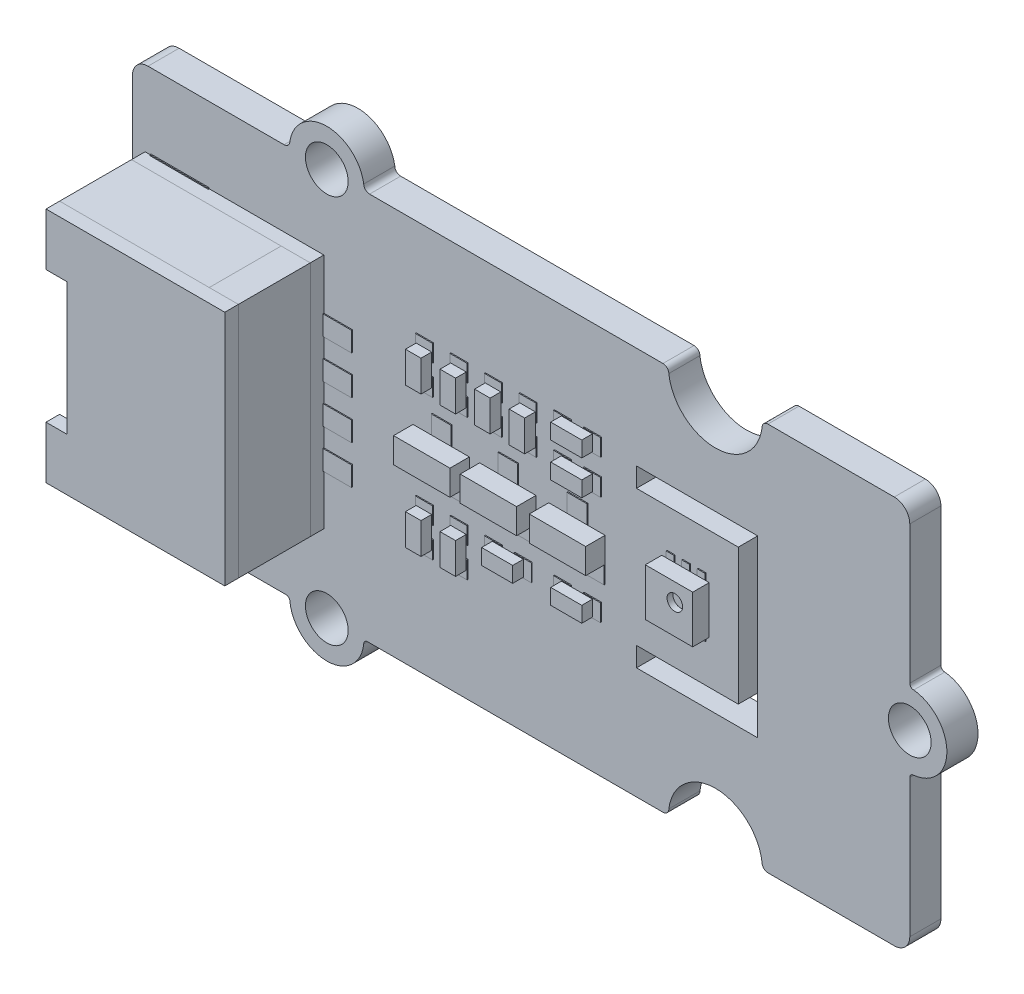
from build123d import *

# Parameters (mm, degrees)
ESQUISSE1_R                                    = 1.1
ESQUISSE1_R_2                                  = 1.100000001
PCB_CONTOUR_PERCAGES_ET_ISOLATION_EAGLE_DEPTH  = 1.6
GROVE_BASE_H_ESTIMEE_START                     = 1.6
ESQUISSE2_W                                    = 9.2
ESQUISSE2_H                                    = 12.2
GROVE_BASE_H_ESTIMEE_DEPTH                     = 0.7
GROVE_DOS_START                                = 2.3
ESQUISSE3_W                                    = 1.5
ESQUISSE3_H                                    = 12.2
GROVE_DOS_DEPTH                                = 3.7
GROVE_FLANCS_START                             = 2.3
ESQUISSE4_W                                    = 7.7
ESQUISSE4_H                                    = 0.7
GROVE_FLANCS_DEPTH                             = 3.7
GROVE_FLANCS_2_DEPTH                           = 3.7
GROVE_TOIT_START                               = 6
ESQUISSE5_W                                    = 9.2
ESQUISSE5_H                                    = 12.2
GROVE_TOIT_DEPTH                               = 0.7
ENCOCHE_GROVE_START                            = 6.7
ESQUISSE6_W                                    = 1.1
ESQUISSE6_H                                    = 6.8
ENCOCHE_GROVE_DEPTH                            = 0.7
BROCHES_HORIZONTALES_GROVE_START               = 3.4
ESQUISSE7_W                                    = 5.52
ESQUISSE7_H                                    = 0.5
BROCHES_HORIZONTALES_GROVE_DEPTH               = 0.5
BROCHES_HORIZONTALES_GROVE_2_DEPTH             = 0.5
BROCHES_HORIZONTALES_GROVE_3_DEPTH             = 0.5
BROCHES_HORIZONTALES_GROVE_4_DEPTH             = 0.5
SGP40_2_44X2_44X0_85_START                     = 1.65
ESQUISSE8_W                                    = 2.44
ESQUISSE8_H                                    = 2.44
SGP40_2_44X2_44X0_85_DEPTH                     = 0.85
OUVERTURE_SGP40_DIAM0_8_PROFONDEUR_ESTIM_START = 2.5
ESQUISSE9_R                                    = 0.4
OUVERTURE_SGP40_DIAM0_8_PROFONDEUR_ESTIM_DEPTH = 0.3
C1_POSITION_EAGLE_START                        = 1.65
ESQUISSE10_W                                   = 1.6
ESQUISSE10_H                                   = 0.8
C1_POSITION_EAGLE_DEPTH                        = 0.55
C2_POSITION_EAGLE_START                        = 1.65
ESQUISSE11_W                                   = 1.6
ESQUISSE11_H                                   = 0.8
C2_POSITION_EAGLE_DEPTH                        = 0.55
U2_POSITION_EAGLE_START                        = 1.65
ESQUISSE12_W                                   = 2.9
ESQUISSE12_H                                   = 1.3
U2_POSITION_EAGLE_DEPTH                        = 1
C3_POSITION_EAGLE_START                        = 1.65
ESQUISSE13_W                                   = 0.8
ESQUISSE13_H                                   = 1.6
C3_POSITION_EAGLE_DEPTH                        = 0.55
C4_POSITION_EAGLE_START                        = 1.65
ESQUISSE14_W                                   = 0.8
ESQUISSE14_H                                   = 1.6
C4_POSITION_EAGLE_DEPTH                        = 0.55
C5_POSITION_EAGLE_START                        = 1.65
ESQUISSE15_W                                   = 0.8
ESQUISSE15_H                                   = 1.6
C5_POSITION_EAGLE_DEPTH                        = 0.55
C6_POSITION_EAGLE_START                        = 1.65
ESQUISSE16_W                                   = 0.8
ESQUISSE16_H                                   = 1.6
C6_POSITION_EAGLE_DEPTH                        = 0.55
Q7_POSITION_EAGLE_START                        = 1.65
ESQUISSE17_W                                   = 2.9
ESQUISSE17_H                                   = 1.3
Q7_POSITION_EAGLE_DEPTH                        = 1
Q8_POSITION_EAGLE_START                        = 1.65
ESQUISSE18_W                                   = 2.9
ESQUISSE18_H                                   = 1.3
Q8_POSITION_EAGLE_DEPTH                        = 1
R20_POSITION_EAGLE_START                       = 1.65
ESQUISSE19_W                                   = 1.6
ESQUISSE19_H                                   = 0.8
R20_POSITION_EAGLE_DEPTH                       = 0.55
R21_POSITION_EAGLE_START                       = 1.65
ESQUISSE20_W                                   = 1.6
ESQUISSE20_H                                   = 0.8
R21_POSITION_EAGLE_DEPTH                       = 0.55
R22_POSITION_EAGLE_START                       = 1.65
ESQUISSE21_W                                   = 0.8
ESQUISSE21_H                                   = 1.6
R22_POSITION_EAGLE_DEPTH                       = 0.55
R23_POSITION_EAGLE_START                       = 1.65
ESQUISSE22_W                                   = 0.8
ESQUISSE22_H                                   = 1.6
R23_POSITION_EAGLE_DEPTH                       = 0.55
PAD_C1_0_START                                 = 1.6
ESQUISSE23_W                                   = 0.889
ESQUISSE23_H                                   = 0.889
PAD_C1_0_DEPTH                                 = 0.05
PAD_C1_1_START                                 = 1.6
ESQUISSE24_W                                   = 0.889
ESQUISSE24_H                                   = 0.889
PAD_C1_1_DEPTH                                 = 0.05
PAD_C2_0_START                                 = 1.6
ESQUISSE25_W                                   = 0.889
ESQUISSE25_H                                   = 0.889
PAD_C2_0_DEPTH                                 = 0.05
PAD_C2_1_START                                 = 1.6
ESQUISSE26_W                                   = 0.889
ESQUISSE26_H                                   = 0.889
PAD_C2_1_DEPTH                                 = 0.05
PAD_J1_0_START                                 = 1.6
ESQUISSE27_W                                   = 2.74
ESQUISSE27_H                                   = 1.01
PAD_J1_0_DEPTH                                 = 0.05
PAD_J1_1_START                                 = 1.6
ESQUISSE28_W                                   = 2.74
ESQUISSE28_H                                   = 1.01
PAD_J1_1_DEPTH                                 = 0.05
PAD_J1_2_START                                 = 1.6
ESQUISSE29_W                                   = 2.74
ESQUISSE29_H                                   = 1.01
PAD_J1_2_DEPTH                                 = 0.05
PAD_J1_3_START                                 = 1.6
ESQUISSE30_W                                   = 2.74
ESQUISSE30_H                                   = 1.01
PAD_J1_3_DEPTH                                 = 0.05
PAD_J1_4_START                                 = 1.6
ESQUISSE31_W                                   = 3
ESQUISSE31_H                                   = 1.5
PAD_J1_4_DEPTH                                 = 0.05
PAD_J1_5_START                                 = 1.6
ESQUISSE32_W                                   = 3
ESQUISSE32_H                                   = 1.5
PAD_J1_5_DEPTH                                 = 0.05
PAD_U2_0_START                                 = 1.6
ESQUISSE33_W                                   = 1.016
ESQUISSE33_H                                   = 1.143
PAD_U2_0_DEPTH                                 = 0.05
PAD_U2_1_START                                 = 1.6
ESQUISSE34_W                                   = 1.016
ESQUISSE34_H                                   = 1.143
PAD_U2_1_DEPTH                                 = 0.05
PAD_U2_2_START                                 = 1.6
ESQUISSE35_W                                   = 1.016
ESQUISSE35_H                                   = 1.143
PAD_U2_2_DEPTH                                 = 0.05
PAD_C3_0_START                                 = 1.6
ESQUISSE36_W                                   = 0.889
ESQUISSE36_H                                   = 0.889
PAD_C3_0_DEPTH                                 = 0.05
PAD_C3_1_START                                 = 1.6
ESQUISSE37_W                                   = 0.889
ESQUISSE37_H                                   = 0.889
PAD_C3_1_DEPTH                                 = 0.05
PAD_C4_0_START                                 = 1.6
ESQUISSE38_W                                   = 0.889
ESQUISSE38_H                                   = 0.889
PAD_C4_0_DEPTH                                 = 0.05
PAD_C4_1_START                                 = 1.6
ESQUISSE39_W                                   = 0.889
ESQUISSE39_H                                   = 0.889
PAD_C4_1_DEPTH                                 = 0.05
PAD_C5_0_START                                 = 1.6
ESQUISSE40_W                                   = 0.889
ESQUISSE40_H                                   = 0.889
PAD_C5_0_DEPTH                                 = 0.05
PAD_C5_1_START                                 = 1.6
ESQUISSE41_W                                   = 0.889
ESQUISSE41_H                                   = 0.889
PAD_C5_1_DEPTH                                 = 0.05
PAD_C6_0_START                                 = 1.6
ESQUISSE42_W                                   = 0.889
ESQUISSE42_H                                   = 0.889
PAD_C6_0_DEPTH                                 = 0.05
PAD_C6_1_START                                 = 1.6
ESQUISSE43_W                                   = 0.889
ESQUISSE43_H                                   = 0.889
PAD_C6_1_DEPTH                                 = 0.05
PAD_Q7_0_START                                 = 1.6
ESQUISSE44_W                                   = 1.016
ESQUISSE44_H                                   = 1.143
PAD_Q7_0_DEPTH                                 = 0.05
PAD_Q7_1_START                                 = 1.6
ESQUISSE45_W                                   = 1.016
ESQUISSE45_H                                   = 1.143
PAD_Q7_1_DEPTH                                 = 0.05
PAD_Q7_2_START                                 = 1.6
ESQUISSE46_W                                   = 1.016
ESQUISSE46_H                                   = 1.143
PAD_Q7_2_DEPTH                                 = 0.05
PAD_Q8_0_START                                 = 1.6
ESQUISSE47_W                                   = 1.016
ESQUISSE47_H                                   = 1.143
PAD_Q8_0_DEPTH                                 = 0.05
PAD_Q8_1_START                                 = 1.6
ESQUISSE48_W                                   = 1.016
ESQUISSE48_H                                   = 1.143
PAD_Q8_1_DEPTH                                 = 0.05
PAD_Q8_2_START                                 = 1.6
ESQUISSE49_W                                   = 1.016
ESQUISSE49_H                                   = 1.143
PAD_Q8_2_DEPTH                                 = 0.05
PAD_R20_0_START                                = 1.6
ESQUISSE50_W                                   = 0.889
ESQUISSE50_H                                   = 0.889
PAD_R20_0_DEPTH                                = 0.05
PAD_R20_1_START                                = 1.6
ESQUISSE51_W                                   = 0.889
ESQUISSE51_H                                   = 0.889
PAD_R20_1_DEPTH                                = 0.05
PAD_R21_0_START                                = 1.6
ESQUISSE52_W                                   = 0.889
ESQUISSE52_H                                   = 0.889
PAD_R21_0_DEPTH                                = 0.05
PAD_R21_1_START                                = 1.6
ESQUISSE53_W                                   = 0.889
ESQUISSE53_H                                   = 0.889
PAD_R21_1_DEPTH                                = 0.05
PAD_R22_0_START                                = 1.6
ESQUISSE54_W                                   = 0.889
ESQUISSE54_H                                   = 0.889
PAD_R22_0_DEPTH                                = 0.05
PAD_R22_1_START                                = 1.6
ESQUISSE55_W                                   = 0.889
ESQUISSE55_H                                   = 0.889
PAD_R22_1_DEPTH                                = 0.05
PAD_R23_0_START                                = 1.6
ESQUISSE56_W                                   = 0.889
ESQUISSE56_H                                   = 0.889
PAD_R23_0_DEPTH                                = 0.05
PAD_R23_1_START                                = 1.6
ESQUISSE57_W                                   = 0.889
ESQUISSE57_H                                   = 0.889
PAD_R23_1_DEPTH                                = 0.05
PAD_U1_0_START                                 = 1.6
ESQUISSE58_W                                   = 0.4
ESQUISSE58_H                                   = 0.65
PAD_U1_0_DEPTH                                 = 0.05
PAD_U1_1_START                                 = 1.6
ESQUISSE59_W                                   = 0.4
ESQUISSE59_H                                   = 0.65
PAD_U1_1_DEPTH                                 = 0.05
PAD_U1_2_START                                 = 1.6
ESQUISSE60_W                                   = 0.4
ESQUISSE60_H                                   = 0.65
PAD_U1_2_DEPTH                                 = 0.05
PAD_U1_3_START                                 = 1.6
ESQUISSE61_W                                   = 0.4
ESQUISSE61_H                                   = 0.65
PAD_U1_3_DEPTH                                 = 0.05
PAD_U1_4_START                                 = 1.6
ESQUISSE62_W                                   = 0.4
ESQUISSE62_H                                   = 0.65
PAD_U1_4_DEPTH                                 = 0.05
PAD_U1_5_START                                 = 1.6
ESQUISSE63_W                                   = 0.4
ESQUISSE63_H                                   = 0.65
PAD_U1_5_DEPTH                                 = 0.05
PAD_U1_6_START                                 = 1.6
ESQUISSE64_W                                   = 1.5
ESQUISSE64_H                                   = 1.05
PAD_U1_6_DEPTH                                 = 0.05


with BuildPart() as part:
    # Esquisse1 → PCB_contour_percages_et_isolation_Eagle_ep_ESTIMEE_1_6 (new body)
    with BuildSketch(Plane.XY):
        with BuildLine():
            Line((19.365, -9.2), (19.365, -2.1))
            ThreePointArc((19.365, -2.1), (19.423578644, -1.958578644), (19.565, -1.9))
            ThreePointArc((19.565, -1.9), (21.275497316, 0), (19.565, 1.9))
            ThreePointArc((19.565, 1.9), (19.423578644, 1.958578644), (19.365, 2.1))
            Line((19.365, 2.1), (19.365, 9.2))
            ThreePointArc((19.365, 9.2), (19.130685425, 9.765685425), (18.565, 10))
            Line((18.565, 10), (12.065, 10))
            ThreePointArc((12.065, 10), (11.852867966, 9.912132034), (11.765, 9.7))
            ThreePointArc((11.765, 9.7), (9.365, 7.581322681), (6.965, 9.7))
            ThreePointArc((6.965, 9.7), (6.877132034, 9.912132034), (6.665, 10))
            Line((6.665, 10), (-8.435, 10))
            ThreePointArc((-8.435, 10), (-8.647132034, 10.087867966), (-8.735, 10.3))
            ThreePointArc((-8.735, 10.3), (-10.635, 11.923538409), (-12.535, 10.3))
            ThreePointArc((-12.535, 10.3), (-12.622867966, 10.087867966), (-12.835, 10))
            Line((-12.835, 10), (-19.835, 10))
            ThreePointArc((-19.835, 10), (-20.400685425, 9.765685425), (-20.635, 9.2))
            Line((-20.635, 9.2), (-20.635, 2.7))
            ThreePointArc((-20.635, 2.7), (-20.547132034, 2.487867966), (-20.335, 2.4))
            ThreePointArc((-20.335, 2.4), (-18.216322681, 0), (-20.335, -2.4))
            ThreePointArc((-20.335, -2.4), (-20.547132034, -2.487867966), (-20.635, -2.7))
            Line((-20.635, -2.7), (-20.635, -9.2))
            ThreePointArc((-20.635, -9.2), (-20.400685425, -9.765685425), (-19.835, -10))
            Line((-19.835, -10), (-12.735, -10))
            ThreePointArc((-12.735, -10), (-12.593578644, -10.058578644), (-12.535, -10.2))
            ThreePointArc((-12.535, -10.2), (-10.635, -11.910497316), (-8.735, -10.2))
            ThreePointArc((-8.735, -10.2), (-8.676421356, -10.058578644), (-8.535, -10))
            Line((-8.535, -10), (6.665, -10))
            ThreePointArc((6.665, -10), (6.877132034, -9.912132034), (6.965, -9.7))
            ThreePointArc((6.965, -9.7), (9.365, -7.581322681), (11.765, -9.7))
            ThreePointArc((11.765, -9.7), (11.852867966, -9.912132034), (12.065, -10))
            Line((12.065, -10), (18.565, -10))
            ThreePointArc((18.565, -10), (19.130685425, -9.765685425), (19.365, -9.2))
        make_face()
        with Locations((-10.635, -9.999999999)):
            Circle(ESQUISSE1_R, mode=Mode.SUBTRACT)
        with Locations((-10.635, 10.000000004)):
            Circle(ESQUISSE1_R, mode=Mode.SUBTRACT)
        with Locations((19.364999999, 0)):
            Circle(ESQUISSE1_R_2, mode=Mode.SUBTRACT)
        Polygon((5.301, 3.754), (10.539, 3.754), (10.539, -3.246), (5.301, -3.246), (5.301, -4.246), (11.539, -4.246), (11.539, 4.754), (5.301, 4.754), align=None, mode=Mode.SUBTRACT)
    extrude(amount=PCB_CONTOUR_PERCAGES_ET_ISOLATION_EAGLE_DEPTH)


with BuildPart() as body_2:
    # Esquisse2 → Grove_base_H_ESTIMEE (new body)
    with BuildSketch(Plane.XY.offset(GROVE_BASE_H_ESTIMEE_START)):
        with Locations((-15.384840625, 0.0101625)):
            Rectangle(ESQUISSE2_W, ESQUISSE2_H)
    extrude(amount=GROVE_BASE_H_ESTIMEE_DEPTH)


with BuildPart() as body_3:
    # Esquisse3 → Grove_dos (new body)
    with BuildSketch(Plane.XY.offset(GROVE_DOS_START)):
        with Locations((-11.534840625, 0.0101625)):
            Rectangle(ESQUISSE3_W, ESQUISSE3_H)
    extrude(amount=GROVE_DOS_DEPTH)


with BuildPart() as body_4:
    # Esquisse4 → Grove_flancs (new body)
    with BuildSketch(Plane.XY.offset(GROVE_FLANCS_START)):
        with Locations((-16.134840625, -5.7398375)):
            Rectangle(ESQUISSE4_W, ESQUISSE4_H)
    extrude(amount=GROVE_FLANCS_DEPTH)


with BuildPart() as body_5:
    # Esquisse4 → Grove_flancs 2 (new body)
    with BuildSketch(Plane.XY.offset(GROVE_FLANCS_START)):
        with Locations((-16.134840625, 5.7601625)):
            Rectangle(ESQUISSE4_W, ESQUISSE4_H)
    extrude(amount=GROVE_FLANCS_2_DEPTH)


with BuildPart() as body_6:
    # Esquisse5 → Grove_toit (new body)
    with BuildSketch(Plane.XY.offset(GROVE_TOIT_START)):
        with Locations((-15.384840625, 0.0101625)):
            Rectangle(ESQUISSE5_W, ESQUISSE5_H)
    extrude(amount=GROVE_TOIT_DEPTH)

    # Esquisse6 → Encoche_Grove (cut)
    with BuildSketch(Plane.XY.offset(ENCOCHE_GROVE_START)):
        with Locations((-19.45, 0.01)):
            Rectangle(ESQUISSE6_W, ESQUISSE6_H)
    extrude(amount=-ENCOCHE_GROVE_DEPTH, mode=Mode.SUBTRACT)


with BuildPart() as body_7:
    # Esquisse7 → Broches_horizontales_Grove (new body)
    with BuildSketch(Plane.XY.offset(BROCHES_HORIZONTALES_GROVE_START)):
        with Locations((-15.04, -2.99)):
            Rectangle(ESQUISSE7_W, ESQUISSE7_H)
    extrude(amount=BROCHES_HORIZONTALES_GROVE_DEPTH)


with BuildPart() as body_8:
    # Esquisse7 → Broches_horizontales_Grove 2 (new body)
    with BuildSketch(Plane.XY.offset(BROCHES_HORIZONTALES_GROVE_START)):
        with Locations((-15.04, -0.99)):
            Rectangle(ESQUISSE7_W, ESQUISSE7_H)
    extrude(amount=BROCHES_HORIZONTALES_GROVE_2_DEPTH)


with BuildPart() as body_9:
    # Esquisse7 → Broches_horizontales_Grove 3 (new body)
    with BuildSketch(Plane.XY.offset(BROCHES_HORIZONTALES_GROVE_START)):
        with Locations((-15.04, 1.01)):
            Rectangle(ESQUISSE7_W, ESQUISSE7_H)
    extrude(amount=BROCHES_HORIZONTALES_GROVE_3_DEPTH)


with BuildPart() as body_10:
    # Esquisse7 → Broches_horizontales_Grove 4 (new body)
    with BuildSketch(Plane.XY.offset(BROCHES_HORIZONTALES_GROVE_START)):
        with Locations((-15.04, 3.01)):
            Rectangle(ESQUISSE7_W, ESQUISSE7_H)
    extrude(amount=BROCHES_HORIZONTALES_GROVE_4_DEPTH)


with BuildPart() as body_11:
    # Esquisse8 → SGP40_2_44x2_44x0_85 (new body)
    with BuildSketch(Plane.XY.offset(SGP40_2_44X2_44X0_85_START)):
        with Locations((7.874, 0.254)):
            Rectangle(ESQUISSE8_W, ESQUISSE8_H)
    extrude(amount=SGP40_2_44X2_44X0_85_DEPTH)

    # Esquisse9 → Ouverture_SGP40_diam0_8_profondeur_ESTIMEE (cut)
    with BuildSketch(Plane.XY.offset(OUVERTURE_SGP40_DIAM0_8_PROFONDEUR_ESTIM_START)):
        with Locations((8.174, 0.554)):
            Circle(ESQUISSE9_R)
    extrude(amount=-OUVERTURE_SGP40_DIAM0_8_PROFONDEUR_ESTIM_DEPTH, mode=Mode.SUBTRACT)


with BuildPart() as body_12:
    # Esquisse10 → C1_position_Eagle (new body)
    with BuildSketch(Plane.XY.offset(C1_POSITION_EAGLE_START)):
        with Locations((2.286, 2.921)):
            Rectangle(ESQUISSE10_W, ESQUISSE10_H)
    extrude(amount=C1_POSITION_EAGLE_DEPTH)


with BuildPart() as body_13:
    # Esquisse11 → C2_position_Eagle (new body)
    with BuildSketch(Plane.XY.offset(C2_POSITION_EAGLE_START)):
        with Locations((2.286, 4.699)):
            Rectangle(ESQUISSE11_W, ESQUISSE11_H)
    extrude(amount=C2_POSITION_EAGLE_DEPTH)


with BuildPart() as body_14:
    # Esquisse12 → U2_position_Eagle (new body)
    with BuildSketch(Plane.XY.offset(U2_POSITION_EAGLE_START)):
        with Locations((-4.699, 0.254)):
            Rectangle(ESQUISSE12_W, ESQUISSE12_H)
    extrude(amount=U2_POSITION_EAGLE_DEPTH)


with BuildPart() as body_15:
    # Esquisse13 → C3_position_Eagle (new body)
    with BuildSketch(Plane.XY.offset(C3_POSITION_EAGLE_START)):
        with Locations((-5.588, 3.81)):
            Rectangle(ESQUISSE13_W, ESQUISSE13_H)
    extrude(amount=C3_POSITION_EAGLE_DEPTH)


with BuildPart() as body_16:
    # Esquisse14 → C4_position_Eagle (new body)
    with BuildSketch(Plane.XY.offset(C4_POSITION_EAGLE_START)):
        with Locations((-3.81, 3.81)):
            Rectangle(ESQUISSE14_W, ESQUISSE14_H)
    extrude(amount=C4_POSITION_EAGLE_DEPTH)


with BuildPart() as body_17:
    # Esquisse15 → C5_position_Eagle (new body)
    with BuildSketch(Plane.XY.offset(C5_POSITION_EAGLE_START)):
        with Locations((-5.588, -3.429)):
            Rectangle(ESQUISSE15_W, ESQUISSE15_H)
    extrude(amount=C5_POSITION_EAGLE_DEPTH)


with BuildPart() as body_18:
    # Esquisse16 → C6_position_Eagle (new body)
    with BuildSketch(Plane.XY.offset(C6_POSITION_EAGLE_START)):
        with Locations((-3.81, -3.429)):
            Rectangle(ESQUISSE16_W, ESQUISSE16_H)
    extrude(amount=C6_POSITION_EAGLE_DEPTH)


with BuildPart() as body_19:
    # Esquisse17 → Q7_position_Eagle (new body)
    with BuildSketch(Plane.XY.offset(Q7_POSITION_EAGLE_START)):
        with Locations((-1.27, 0.254)):
            Rectangle(ESQUISSE17_W, ESQUISSE17_H)
    extrude(amount=Q7_POSITION_EAGLE_DEPTH)


with BuildPart() as body_20:
    # Esquisse18 → Q8_position_Eagle (new body)
    with BuildSketch(Plane.XY.offset(Q8_POSITION_EAGLE_START)):
        with Locations((2.286, 0.254)):
            Rectangle(ESQUISSE18_W, ESQUISSE18_H)
    extrude(amount=Q8_POSITION_EAGLE_DEPTH)


with BuildPart() as body_21:
    # Esquisse19 → R20_position_Eagle (new body)
    with BuildSketch(Plane.XY.offset(R20_POSITION_EAGLE_START)):
        with Locations((2.286, -2.667)):
            Rectangle(ESQUISSE19_W, ESQUISSE19_H)
    extrude(amount=R20_POSITION_EAGLE_DEPTH)


with BuildPart() as body_22:
    # Esquisse20 → R21_position_Eagle (new body)
    with BuildSketch(Plane.XY.offset(R21_POSITION_EAGLE_START)):
        with Locations((-1.27, -2.667)):
            Rectangle(ESQUISSE20_W, ESQUISSE20_H)
    extrude(amount=R21_POSITION_EAGLE_DEPTH)


with BuildPart() as body_23:
    # Esquisse21 → R22_position_Eagle (new body)
    with BuildSketch(Plane.XY.offset(R22_POSITION_EAGLE_START)):
        with Locations((-0.254, 3.81)):
            Rectangle(ESQUISSE21_W, ESQUISSE21_H)
    extrude(amount=R22_POSITION_EAGLE_DEPTH)


with BuildPart() as body_24:
    # Esquisse22 → R23_position_Eagle (new body)
    with BuildSketch(Plane.XY.offset(R23_POSITION_EAGLE_START)):
        with Locations((-2.032, 3.81)):
            Rectangle(ESQUISSE22_W, ESQUISSE22_H)
    extrude(amount=R23_POSITION_EAGLE_DEPTH)


with BuildPart() as body_25:
    # Esquisse23 → Pad_C1_0 (new body)
    with BuildSketch(Plane.XY.offset(PAD_C1_0_START)):
        with Locations((3.048, 2.921)):
            Rectangle(ESQUISSE23_W, ESQUISSE23_H)
    extrude(amount=PAD_C1_0_DEPTH)


with BuildPart() as body_26:
    # Esquisse24 → Pad_C1_1 (new body)
    with BuildSketch(Plane.XY.offset(PAD_C1_1_START)):
        with Locations((1.524, 2.921)):
            Rectangle(ESQUISSE24_W, ESQUISSE24_H)
    extrude(amount=PAD_C1_1_DEPTH)


with BuildPart() as body_27:
    # Esquisse25 → Pad_C2_0 (new body)
    with BuildSketch(Plane.XY.offset(PAD_C2_0_START)):
        with Locations((3.048, 4.699)):
            Rectangle(ESQUISSE25_W, ESQUISSE25_H)
    extrude(amount=PAD_C2_0_DEPTH)


with BuildPart() as body_28:
    # Esquisse26 → Pad_C2_1 (new body)
    with BuildSketch(Plane.XY.offset(PAD_C2_1_START)):
        with Locations((1.524, 4.699)):
            Rectangle(ESQUISSE26_W, ESQUISSE26_H)
    extrude(amount=PAD_C2_1_DEPTH)


with BuildPart() as body_29:
    # Esquisse27 → Pad_J1_0 (new body)
    with BuildSketch(Plane.XY.offset(PAD_J1_0_START)):
        with Locations((-10.68484063, -2.9898375)):
            Rectangle(ESQUISSE27_W, ESQUISSE27_H)
    extrude(amount=PAD_J1_0_DEPTH)


with BuildPart() as body_30:
    # Esquisse28 → Pad_J1_1 (new body)
    with BuildSketch(Plane.XY.offset(PAD_J1_1_START)):
        with Locations((-10.68484063, -0.9898375)):
            Rectangle(ESQUISSE28_W, ESQUISSE28_H)
    extrude(amount=PAD_J1_1_DEPTH)


with BuildPart() as body_31:
    # Esquisse29 → Pad_J1_2 (new body)
    with BuildSketch(Plane.XY.offset(PAD_J1_2_START)):
        with Locations((-10.68484063, 1.0101625)):
            Rectangle(ESQUISSE29_W, ESQUISSE29_H)
    extrude(amount=PAD_J1_2_DEPTH)


with BuildPart() as body_32:
    # Esquisse30 → Pad_J1_3 (new body)
    with BuildSketch(Plane.XY.offset(PAD_J1_3_START)):
        with Locations((-10.68484063, 3.0101625)):
            Rectangle(ESQUISSE30_W, ESQUISSE30_H)
    extrude(amount=PAD_J1_3_DEPTH)


with BuildPart() as body_33:
    # Esquisse31 → Pad_J1_4 (new body)
    with BuildSketch(Plane.XY.offset(PAD_J1_4_START)):
        with Locations((-18.18484062, -5.3898375)):
            Rectangle(ESQUISSE31_W, ESQUISSE31_H)
    extrude(amount=PAD_J1_4_DEPTH)


with BuildPart() as body_34:
    # Esquisse32 → Pad_J1_5 (new body)
    with BuildSketch(Plane.XY.offset(PAD_J1_5_START)):
        with Locations((-18.18484062, 5.4101625)):
            Rectangle(ESQUISSE32_W, ESQUISSE32_H)
    extrude(amount=PAD_J1_5_DEPTH)


with BuildPart() as body_35:
    # Esquisse33 → Pad_U2_0 (new body)
    with BuildSketch(Plane.XY.offset(PAD_U2_0_START)):
        with Locations((-4.699, 1.27)):
            Rectangle(ESQUISSE33_W, ESQUISSE33_H)
    extrude(amount=PAD_U2_0_DEPTH)


with BuildPart() as body_36:
    # Esquisse34 → Pad_U2_1 (new body)
    with BuildSketch(Plane.XY.offset(PAD_U2_1_START)):
        with Locations((-3.81, -0.762)):
            Rectangle(ESQUISSE34_W, ESQUISSE34_H)
    extrude(amount=PAD_U2_1_DEPTH)


with BuildPart() as body_37:
    # Esquisse35 → Pad_U2_2 (new body)
    with BuildSketch(Plane.XY.offset(PAD_U2_2_START)):
        with Locations((-5.588, -0.762)):
            Rectangle(ESQUISSE35_W, ESQUISSE35_H)
    extrude(amount=PAD_U2_2_DEPTH)


with BuildPart() as body_38:
    # Esquisse36 → Pad_C3_0 (new body)
    with BuildSketch(Plane.XY.offset(PAD_C3_0_START)):
        with Locations((-5.588, 3.048)):
            Rectangle(ESQUISSE36_W, ESQUISSE36_H)
    extrude(amount=PAD_C3_0_DEPTH)


with BuildPart() as body_39:
    # Esquisse37 → Pad_C3_1 (new body)
    with BuildSketch(Plane.XY.offset(PAD_C3_1_START)):
        with Locations((-5.588, 4.572)):
            Rectangle(ESQUISSE37_W, ESQUISSE37_H)
    extrude(amount=PAD_C3_1_DEPTH)


with BuildPart() as body_40:
    # Esquisse38 → Pad_C4_0 (new body)
    with BuildSketch(Plane.XY.offset(PAD_C4_0_START)):
        with Locations((-3.81, 3.048)):
            Rectangle(ESQUISSE38_W, ESQUISSE38_H)
    extrude(amount=PAD_C4_0_DEPTH)


with BuildPart() as body_41:
    # Esquisse39 → Pad_C4_1 (new body)
    with BuildSketch(Plane.XY.offset(PAD_C4_1_START)):
        with Locations((-3.81, 4.572)):
            Rectangle(ESQUISSE39_W, ESQUISSE39_H)
    extrude(amount=PAD_C4_1_DEPTH)


with BuildPart() as body_42:
    # Esquisse40 → Pad_C5_0 (new body)
    with BuildSketch(Plane.XY.offset(PAD_C5_0_START)):
        with Locations((-5.588, -2.667)):
            Rectangle(ESQUISSE40_W, ESQUISSE40_H)
    extrude(amount=PAD_C5_0_DEPTH)


with BuildPart() as body_43:
    # Esquisse41 → Pad_C5_1 (new body)
    with BuildSketch(Plane.XY.offset(PAD_C5_1_START)):
        with Locations((-5.588, -4.191)):
            Rectangle(ESQUISSE41_W, ESQUISSE41_H)
    extrude(amount=PAD_C5_1_DEPTH)


with BuildPart() as body_44:
    # Esquisse42 → Pad_C6_0 (new body)
    with BuildSketch(Plane.XY.offset(PAD_C6_0_START)):
        with Locations((-3.81, -2.667)):
            Rectangle(ESQUISSE42_W, ESQUISSE42_H)
    extrude(amount=PAD_C6_0_DEPTH)


with BuildPart() as body_45:
    # Esquisse43 → Pad_C6_1 (new body)
    with BuildSketch(Plane.XY.offset(PAD_C6_1_START)):
        with Locations((-3.81, -4.191)):
            Rectangle(ESQUISSE43_W, ESQUISSE43_H)
    extrude(amount=PAD_C6_1_DEPTH)


with BuildPart() as body_46:
    # Esquisse44 → Pad_Q7_0 (new body)
    with BuildSketch(Plane.XY.offset(PAD_Q7_0_START)):
        with Locations((-1.27, 1.27)):
            Rectangle(ESQUISSE44_W, ESQUISSE44_H)
    extrude(amount=PAD_Q7_0_DEPTH)


with BuildPart() as body_47:
    # Esquisse45 → Pad_Q7_1 (new body)
    with BuildSketch(Plane.XY.offset(PAD_Q7_1_START)):
        with Locations((-0.381, -0.762)):
            Rectangle(ESQUISSE45_W, ESQUISSE45_H)
    extrude(amount=PAD_Q7_1_DEPTH)


with BuildPart() as body_48:
    # Esquisse46 → Pad_Q7_2 (new body)
    with BuildSketch(Plane.XY.offset(PAD_Q7_2_START)):
        with Locations((-2.159, -0.762)):
            Rectangle(ESQUISSE46_W, ESQUISSE46_H)
    extrude(amount=PAD_Q7_2_DEPTH)


with BuildPart() as body_49:
    # Esquisse47 → Pad_Q8_0 (new body)
    with BuildSketch(Plane.XY.offset(PAD_Q8_0_START)):
        with Locations((2.286, 1.27)):
            Rectangle(ESQUISSE47_W, ESQUISSE47_H)
    extrude(amount=PAD_Q8_0_DEPTH)


with BuildPart() as body_50:
    # Esquisse48 → Pad_Q8_1 (new body)
    with BuildSketch(Plane.XY.offset(PAD_Q8_1_START)):
        with Locations((3.175, -0.762)):
            Rectangle(ESQUISSE48_W, ESQUISSE48_H)
    extrude(amount=PAD_Q8_1_DEPTH)


with BuildPart() as body_51:
    # Esquisse49 → Pad_Q8_2 (new body)
    with BuildSketch(Plane.XY.offset(PAD_Q8_2_START)):
        with Locations((1.397, -0.762)):
            Rectangle(ESQUISSE49_W, ESQUISSE49_H)
    extrude(amount=PAD_Q8_2_DEPTH)


with BuildPart() as body_52:
    # Esquisse50 → Pad_R20_0 (new body)
    with BuildSketch(Plane.XY.offset(PAD_R20_0_START)):
        with Locations((1.524, -2.667)):
            Rectangle(ESQUISSE50_W, ESQUISSE50_H)
    extrude(amount=PAD_R20_0_DEPTH)


with BuildPart() as body_53:
    # Esquisse51 → Pad_R20_1 (new body)
    with BuildSketch(Plane.XY.offset(PAD_R20_1_START)):
        with Locations((3.048, -2.667)):
            Rectangle(ESQUISSE51_W, ESQUISSE51_H)
    extrude(amount=PAD_R20_1_DEPTH)


with BuildPart() as body_54:
    # Esquisse52 → Pad_R21_0 (new body)
    with BuildSketch(Plane.XY.offset(PAD_R21_0_START)):
        with Locations((-2.032, -2.667)):
            Rectangle(ESQUISSE52_W, ESQUISSE52_H)
    extrude(amount=PAD_R21_0_DEPTH)


with BuildPart() as body_55:
    # Esquisse53 → Pad_R21_1 (new body)
    with BuildSketch(Plane.XY.offset(PAD_R21_1_START)):
        with Locations((-0.508, -2.667)):
            Rectangle(ESQUISSE53_W, ESQUISSE53_H)
    extrude(amount=PAD_R21_1_DEPTH)


with BuildPart() as body_56:
    # Esquisse54 → Pad_R22_0 (new body)
    with BuildSketch(Plane.XY.offset(PAD_R22_0_START)):
        with Locations((-0.254, 4.572)):
            Rectangle(ESQUISSE54_W, ESQUISSE54_H)
    extrude(amount=PAD_R22_0_DEPTH)


with BuildPart() as body_57:
    # Esquisse55 → Pad_R22_1 (new body)
    with BuildSketch(Plane.XY.offset(PAD_R22_1_START)):
        with Locations((-0.254, 3.048)):
            Rectangle(ESQUISSE55_W, ESQUISSE55_H)
    extrude(amount=PAD_R22_1_DEPTH)


with BuildPart() as body_58:
    # Esquisse56 → Pad_R23_0 (new body)
    with BuildSketch(Plane.XY.offset(PAD_R23_0_START)):
        with Locations((-2.032, 4.572)):
            Rectangle(ESQUISSE56_W, ESQUISSE56_H)
    extrude(amount=PAD_R23_0_DEPTH)


with BuildPart() as body_59:
    # Esquisse57 → Pad_R23_1 (new body)
    with BuildSketch(Plane.XY.offset(PAD_R23_1_START)):
        with Locations((-2.032, 3.048)):
            Rectangle(ESQUISSE57_W, ESQUISSE57_H)
    extrude(amount=PAD_R23_1_DEPTH)


with BuildPart() as body_60:
    # Esquisse58 → Pad_U1_0 (new body)
    with BuildSketch(Plane.XY.offset(PAD_U1_0_START)):
        with Locations((7.074, -0.946)):
            Rectangle(ESQUISSE58_W, ESQUISSE58_H)
    extrude(amount=PAD_U1_0_DEPTH)


with BuildPart() as body_61:
    # Esquisse59 → Pad_U1_1 (new body)
    with BuildSketch(Plane.XY.offset(PAD_U1_1_START)):
        with Locations((7.874, -0.946)):
            Rectangle(ESQUISSE59_W, ESQUISSE59_H)
    extrude(amount=PAD_U1_1_DEPTH)


with BuildPart() as body_62:
    # Esquisse60 → Pad_U1_2 (new body)
    with BuildSketch(Plane.XY.offset(PAD_U1_2_START)):
        with Locations((8.674, -0.946)):
            Rectangle(ESQUISSE60_W, ESQUISSE60_H)
    extrude(amount=PAD_U1_2_DEPTH)


with BuildPart() as body_63:
    # Esquisse61 → Pad_U1_3 (new body)
    with BuildSketch(Plane.XY.offset(PAD_U1_3_START)):
        with Locations((8.674, 1.454)):
            Rectangle(ESQUISSE61_W, ESQUISSE61_H)
    extrude(amount=PAD_U1_3_DEPTH)


with BuildPart() as body_64:
    # Esquisse62 → Pad_U1_4 (new body)
    with BuildSketch(Plane.XY.offset(PAD_U1_4_START)):
        with Locations((7.874, 1.454)):
            Rectangle(ESQUISSE62_W, ESQUISSE62_H)
    extrude(amount=PAD_U1_4_DEPTH)


with BuildPart() as body_65:
    # Esquisse63 → Pad_U1_5 (new body)
    with BuildSketch(Plane.XY.offset(PAD_U1_5_START)):
        with Locations((7.074, 1.454)):
            Rectangle(ESQUISSE63_W, ESQUISSE63_H)
    extrude(amount=PAD_U1_5_DEPTH)


with BuildPart() as body_66:
    # Esquisse64 → Pad_U1_6 (new body)
    with BuildSketch(Plane.XY.offset(PAD_U1_6_START)):
        with Locations((7.874, 0.254)):
            Rectangle(ESQUISSE64_W, ESQUISSE64_H)
    extrude(amount=PAD_U1_6_DEPTH)


solid = Compound([part.part, body_2.part, body_3.part, body_4.part, body_5.part, body_6.part, body_7.part, body_8.part, body_9.part, body_10.part, body_11.part, body_12.part, body_13.part, body_14.part, body_15.part, body_16.part, body_17.part, body_18.part, body_19.part, body_20.part, body_21.part, body_22.part, body_23.part, body_24.part, body_25.part, body_26.part, body_27.part, body_28.part, body_29.part, body_30.part, body_31.part, body_32.part, body_33.part, body_34.part, body_35.part, body_36.part, body_37.part, body_38.part, body_39.part, body_40.part, body_41.part, body_42.part, body_43.part, body_44.part, body_45.part, body_46.part, body_47.part, body_48.part, body_49.part, body_50.part, body_51.part, body_52.part, body_53.part, body_54.part, body_55.part, body_56.part, body_57.part, body_58.part, body_59.part, body_60.part, body_61.part, body_62.part, body_63.part, body_64.part, body_65.part, body_66.part])
